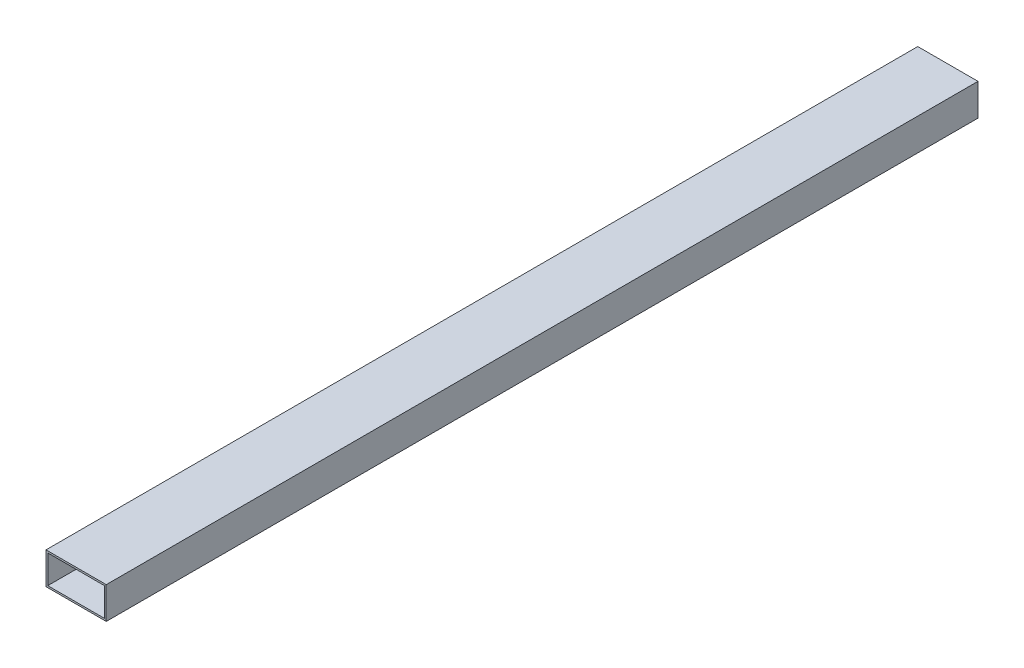
from build123d import *

# Parameters (mm, degrees)
SKETCH1_W           = 53.975
SKETCH1_H           = 28.575
SKETCH1_W_2         = 50.8
SKETCH1_H_2         = 25.4
EXTRUDE_THIN1_DEPTH = 781.05


with BuildPart() as part:
    # Sketch1 → Extrude-Thin1 (new body)
    with BuildSketch(Plane.XY):
        with Locations((-25.4, -12.7)):
            Rectangle(SKETCH1_W, SKETCH1_H)
        with Locations((-25.4, -12.7)):
            Rectangle(SKETCH1_W_2, SKETCH1_H_2, mode=Mode.SUBTRACT)
    extrude(amount=EXTRUDE_THIN1_DEPTH)


solid = part.part
